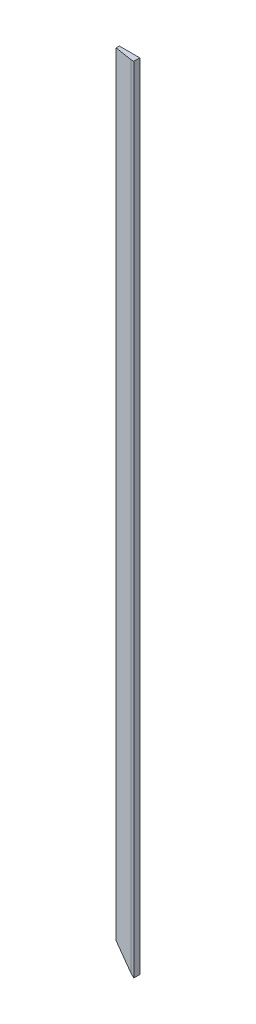
from build123d import *

# Parameters (mm, degrees)
BOSS_EXTRUDE1_DEPTH = 2092.325
CUT_EXTRUDE2_DEPTH  = 2094.081274551


with BuildPart() as part:
    # Sketch1 → Boss-Extrude1 (new body)
    with BuildSketch(Plane(origin=(0, 0, 0), x_dir=(1, 0, 0), z_dir=(0, 1, 0))):
        Polygon((0, 0), (53.975, 0), (53.975, -15.875), (46.355, -15.875), (0, -8.255), align=None)
    extrude(amount=BOSS_EXTRUDE1_DEPTH)

    # Sketch3 → Cut-Extrude2 (cut, through all)
    with BuildSketch(Plane.XY.offset(15.875)):
        Polygon((53.975, 0), (0, 53.975), (0, 0), align=None)
    extrude(amount=-CUT_EXTRUDE2_DEPTH, mode=Mode.SUBTRACT)


solid = part.part
